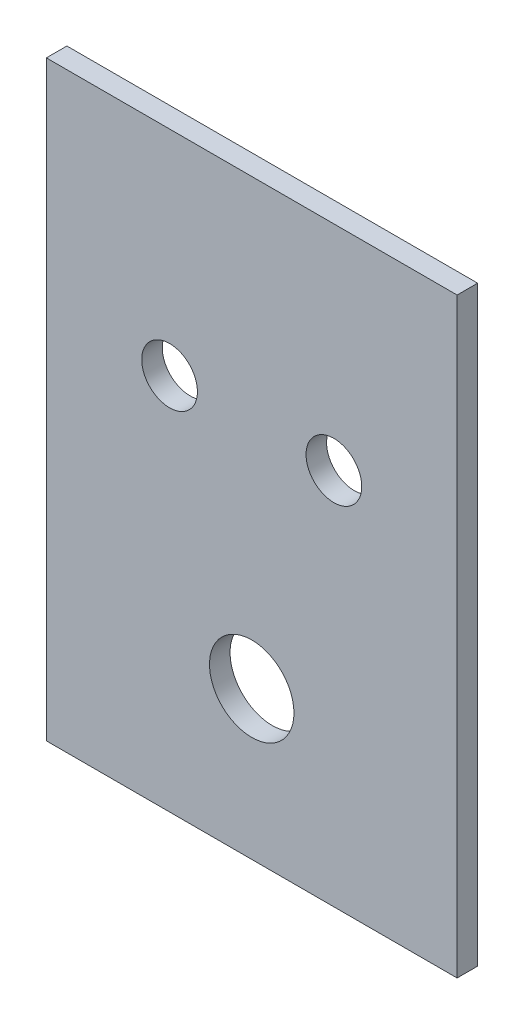
from build123d import *

# Parameters (mm, degrees)
SKETCH2_W           = 31.75
SKETCH2_H           = 45.72
SKETCH2_R           = 2.15265
SKETCH2_R_2         = 3.2639
BOSS_EXTRUDE1_DEPTH = 1.5875


with BuildPart() as part:
    # Sketch2 → Boss-Extrude1 (new body)
    with BuildSketch(Plane.XY):
        with Locations((15.875, 22.86)):
            Rectangle(SKETCH2_W, SKETCH2_H)
        with Locations((9.525, 29.21)):
            Circle(SKETCH2_R, mode=Mode.SUBTRACT)
        with Locations((22.225, 29.21)):
            Circle(SKETCH2_R, mode=Mode.SUBTRACT)
        with Locations((15.875, 11.43)):
            Circle(SKETCH2_R_2, mode=Mode.SUBTRACT)
    extrude(amount=BOSS_EXTRUDE1_DEPTH)


solid = part.part
